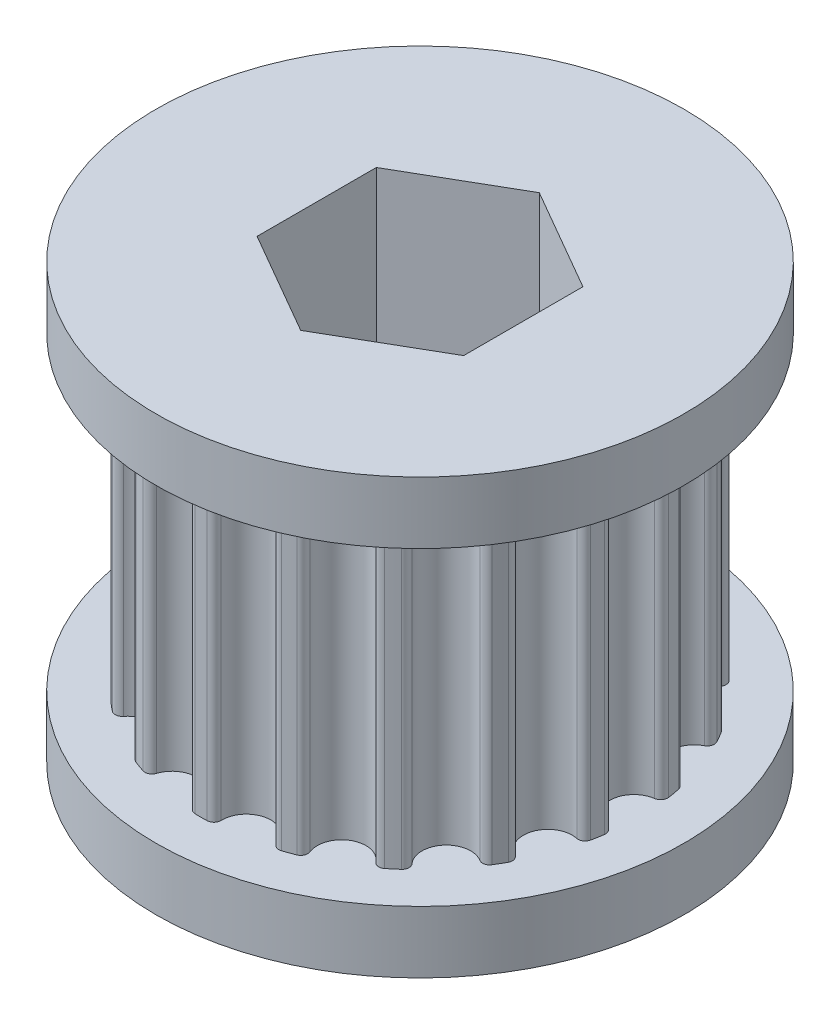
from build123d import *

# Parameters (mm, degrees)
MOUNTINGHOLES_R         = 14.323949
BOSS_EXTRUDE1_DEPTH     = 9.525
CUT_EXTRUDE1_DEPTH      = 19.05
CIRPATTERN1_COUNT       = 18
FLANGE_R                = 16.228949
BOSS_EXTRUDE2_DEPTH     = 3.81
BOSS_EXTRUDE3_START     = 3.81
SKETCH6_R               = 16.228949
BOSS_EXTRUDE3_DEPTH     = 3.81
CUT_EXTRUDE5_DEPTH      = 32.512
CUT_EXTRUDE5_DEPTH_BACK = 31.242


with BuildPart() as part:
    # mountingHoles → Boss-Extrude1 (new, symmetric)
    with BuildSketch(Plane(origin=(0, 0, 0), x_dir=(1, 0, 0), z_dir=(0, 1, 0))):
        Circle(MOUNTINGHOLES_R)
    extrude(amount=BOSS_EXTRUDE1_DEPTH, both=True)

    # Sketch2 → Cut-Extrude1 (cut)
    with BuildSketch(Plane(origin=(0, 9.525, 0), x_dir=(1, 0, 0), z_dir=(0, 1, 0))):
        with BuildLine():
            Line((0, 13.460349), (0, 14.323949))
            ThreePointArc((0, 14.323949), (2.487327641, 14.106336029), (4.89907909, 13.460109176))
            Line((4.89907909, 13.460109176), (4.603710494, 12.648590629))
            ThreePointArc((4.603710494, 12.648590629), (4.430828603, 12.710183047), (4.257123016, 12.769412627))
            ThreePointArc((4.257123016, 12.769412627), (3.925929741, 12.745227134), (3.709846002, 12.493072933))
            ThreePointArc((3.709846002, 12.493072933), (2.024207951, 11.479853752), (0.786767683, 13.008490507))
            ThreePointArc((0.786767683, 13.008490507), (0.669957204, 13.319342941), (0.367009253, 13.455344641))
            ThreePointArc((0.367009253, 13.455344641), (0.183521685, 13.459097852), (0, 13.460349))
        make_face()
    cut_extrude1 = extrude(amount=-CUT_EXTRUDE1_DEPTH, mode=Mode.SUBTRACT)

    # CirPattern1: Cut-Extrude1 ×18 about axis
    cirpattern1_axis = Axis((0, 9.525, 0), (0, -1, 0))
    for i in range(1, CIRPATTERN1_COUNT):
        add(cut_extrude1.rotate(cirpattern1_axis, i * 360 / CIRPATTERN1_COUNT), mode=Mode.SUBTRACT)

    # flange → Boss-Extrude2 (add)
    with BuildSketch(Plane(origin=(0, 9.525, 0), x_dir=(1, 0, 0), z_dir=(0, 1, 0))):
        Circle(FLANGE_R)
    extrude(amount=BOSS_EXTRUDE2_DEPTH)

    # Sketch6 → Boss-Extrude3 (add)
    with BuildSketch(Plane.XZ.offset(9.525).offset(BOSS_EXTRUDE3_START)):
        Circle(SKETCH6_R)
    extrude(amount=-BOSS_EXTRUDE3_DEPTH)

    # Sketch1<5> → Cut-Extrude5 (cut, two sides: drawn at the far end of the back side and taken through both)
    with BuildSketch(Plane(origin=(0, 0, 0), x_dir=(1, 0, 0), z_dir=(0, 1, 0)).offset(-CUT_EXTRUDE5_DEPTH_BACK)):
        Polygon((0, 7.332348419), (-6.35, 3.666174209), (-6.35, -3.666174209), (0, -7.332348419), (6.35, -3.666174209), (6.35, 3.666174209), align=None)
    extrude(amount=CUT_EXTRUDE5_DEPTH + CUT_EXTRUDE5_DEPTH_BACK, mode=Mode.SUBTRACT)


solid = part.part
